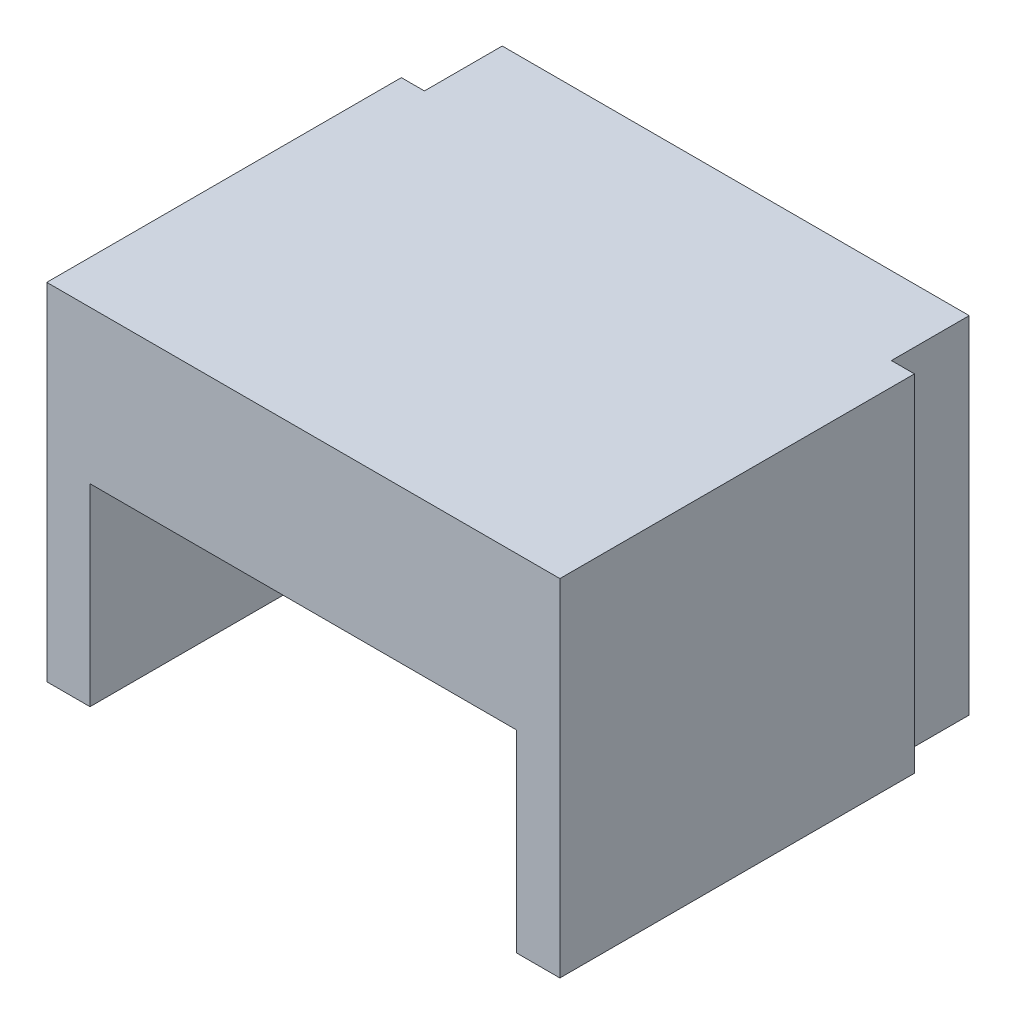
from build123d import *

# Parameters (mm, degrees)
SKETCH1_W           = 17.8
SKETCH1_H           = 12
BOSS_EXTRUDE1_DEPTH = 15
SKETCH2_W           = 14.8
SKETCH2_H           = 7.5
CUT_EXTRUDE1_DEPTH  = 27.188547115
SKETCH3_W           = 14.8
SKETCH3_H           = 11.449984897
BOSS_EXTRUDE2_DEPTH = 0.8
SKETCH4_W           = 0.8
SKETCH4_H           = 12
CUT_EXTRUDE2_DEPTH  = 2.7


with BuildPart() as part:
    # Sketch1 → Boss-Extrude1 (new body)
    with BuildSketch(Plane.XY):
        with Locations((8.9, 6)):
            Rectangle(SKETCH1_W, SKETCH1_H)
    extrude(amount=BOSS_EXTRUDE1_DEPTH)

    # Sketch2 → Cut-Extrude1 (cut, through all)
    with BuildSketch(Plane.XY.offset(15)):
        with Locations((8.9, 3.75)):
            Rectangle(SKETCH2_W, SKETCH2_H)
    extrude(amount=-CUT_EXTRUDE1_DEPTH, mode=Mode.SUBTRACT)

    # Sketch3 → Boss-Extrude2 (add)
    with BuildSketch(Plane.XZ.offset(-7.5)):
        with Locations((8.9, 9.275007552)):
            Rectangle(SKETCH3_W, SKETCH3_H)
    extrude(amount=BOSS_EXTRUDE2_DEPTH)

    # Sketch4 → Cut-Extrude2 (cut)
    with BuildSketch(Plane(origin=(0, 0, 0), x_dir=(-1, 0, 0), z_dir=(0, 0, -1))):
        with Locations((-17.4, 6)):
            Rectangle(SKETCH4_W, SKETCH4_H)
        with Locations((-0.4, 6)):
            Rectangle(SKETCH4_W, SKETCH4_H)
    extrude(amount=-CUT_EXTRUDE2_DEPTH, mode=Mode.SUBTRACT)


solid = part.part
